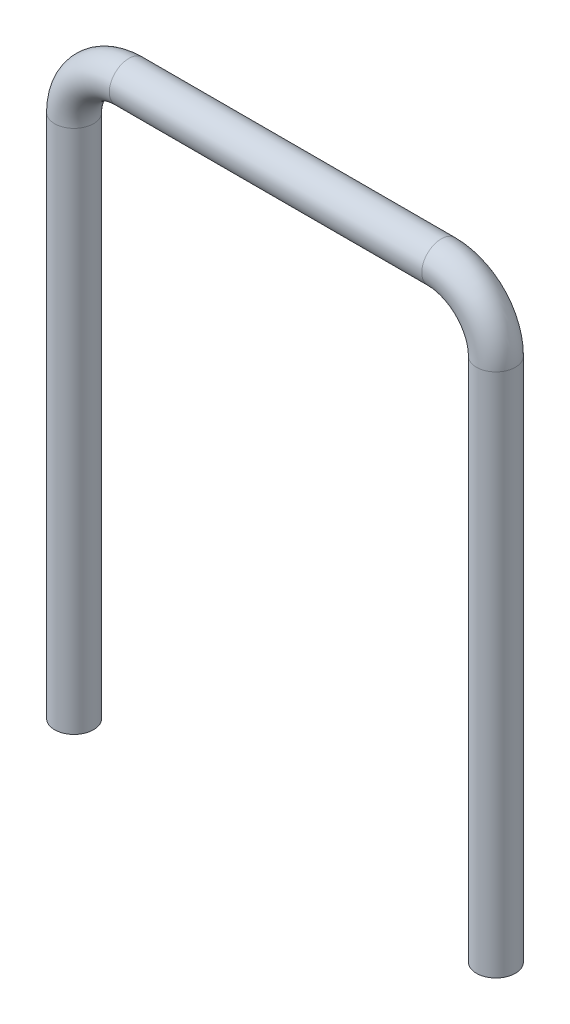
from build123d import *

# Parameters (mm, degrees)
SKETCH1_R = 0.3556


with BuildPart() as part:
    # Sweep1: sweep along a path in Sketch2
    with BuildLine(Plane.XY) as sweep1_path:
        Line((0, 0), (0, 9.5944))
        ThreePointArc((0, 9.5944), (0.292893219, 10.301506781), (1, 10.5944))
        Line((1, 10.5944), (6.7112, 10.5944))
        ThreePointArc((6.7112, 10.5944), (7.418306781, 10.301506781), (7.7112, 9.5944))
        Line((7.7112, 9.5944), (7.7112, 0))
    # Sketch1 → Sweep1 (sweep)
    with BuildSketch(Plane(origin=(0, 0, 0), x_dir=(1, 0, 0), z_dir=(0, 1, 0))):
        Circle(SKETCH1_R)
    sweep(path=sweep1_path.line)


solid = part.part
